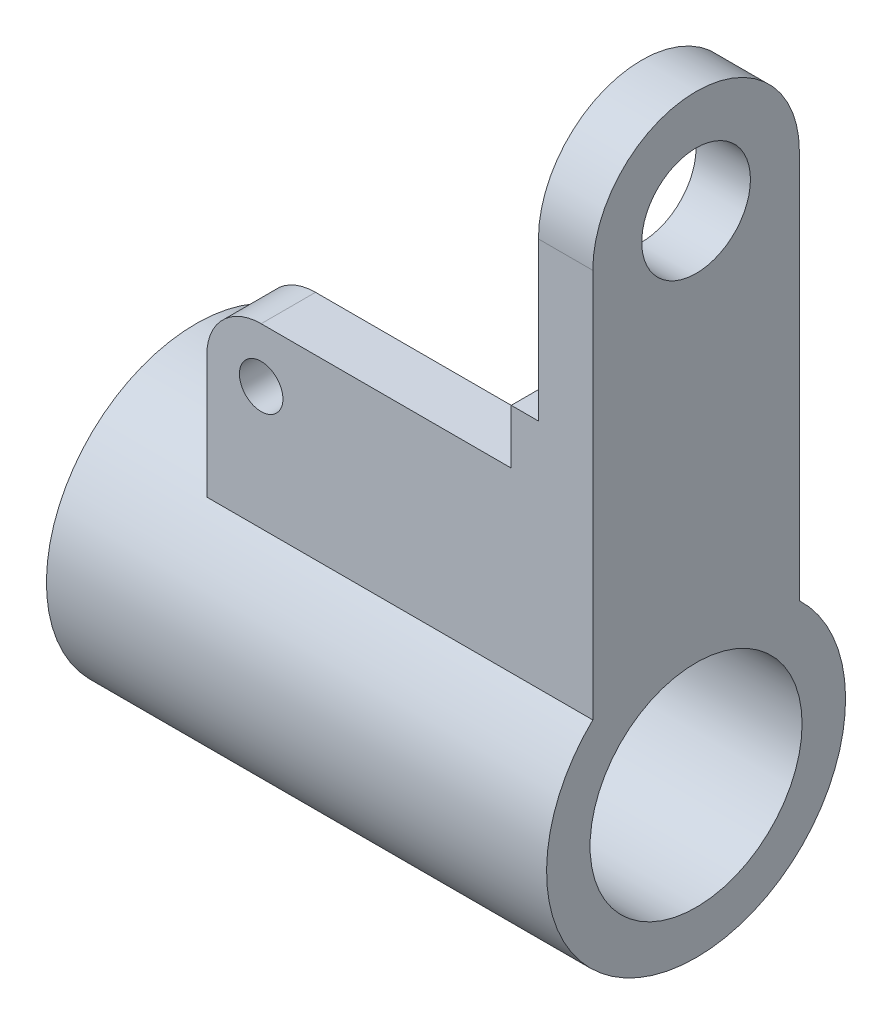
from build123d import *

# Parameters (mm, degrees)
SKETCH_1_R          = 27.5
SKETCH_1_R_2        = 19.5
EXTRUDE_1_DEPTH     = 92
EXTRUDE_START       = -15
SKETCH_2_R          = 10
EXTRUDE_2_DEPTH     = 15
CUT_EXTRUDE_1_REACH = 153.118
SKETCH_3_W          = 5
SKETCH_3_H          = 48
EXTRUDE_START_2     = 56
EXTRUDE_3_DEPTH     = 56
FILLET_1_R          = 10
CUT_EXTRUDE_2_REACH = 153.118
SKETCH_7_R          = 4


with BuildPart() as part:
    # 草图1 → 凸台-拉伸1 (new body)
    with BuildSketch(Plane(origin=(0, 0, 0), x_dir=(0, 0, -1), z_dir=(1, 0, 0))):
        Circle(SKETCH_1_R)
        Circle(SKETCH_1_R_2, mode=Mode.SUBTRACT)
    extrude(amount=EXTRUDE_1_DEPTH)

    # 草图2 → 凸台-拉伸2 (add)
    with BuildSketch(Plane(origin=(92, 0, 0), x_dir=(0, 0, -1), z_dir=(1, 0, 0)).offset(EXTRUDE_START)):
        with BuildLine():
            Line((-19, 19.880895352), (-19, 91.5))
            ThreePointArc((-19, 91.5), (0, 110.5), (19, 91.5))
            Line((19, 91.5), (19, 19.880895352))
            ThreePointArc((19, 19.880895352), (0, 27.5), (-19, 19.880895352))
        make_face()
        with Locations((0, 91.5)):
            Circle(SKETCH_2_R, mode=Mode.SUBTRACT)
    extrude(amount=EXTRUDE_2_DEPTH)

    # 草图3 → 切除-拉伸1 (cut, up to next)
    with BuildSketch(Plane.XY.offset(19), mode=Mode.PRIVATE) as cut_extrude_1_sk1:
        with Locations((79.5, 86.5)):
            Rectangle(SKETCH_3_W, SKETCH_3_H)
    cut_extrude_1_tool1 = extrude(cut_extrude_1_sk1.sketch, amount=-CUT_EXTRUDE_1_REACH, mode=Mode.PRIVATE) & part.part
    add(cut_extrude_1_tool1.solids().sort_by_distance((79.5, 86.5, 19))[0], mode=Mode.SUBTRACT)

    # 草图6 → 凸台-拉伸3 (add)
    with BuildSketch(Plane.ZY.offset(-77).offset(EXTRUDE_START_2)):
        with BuildLine():
            Line((19, 19.880895352), (19, 52.5))
            Line((19, 52.5), (9, 52.5))
            Line((9, 52.5), (9, 25.98557292))
            ThreePointArc((9, 25.98557292), (14.328878953, 23.471966853), (19, 19.880895352))
        make_face()
    extrude(amount=-EXTRUDE_3_DEPTH)

    # 圆角1
    fillet_1_edges = [part.edges().sort_by_distance(p)[0] for p in [
        (21, 52.5, 14),
    ]]
    fillet(fillet_1_edges, radius=FILLET_1_R)

    # 草图7 → 切除-拉伸2 (cut, up to next)
    with BuildSketch(Plane.XY.offset(19), mode=Mode.PRIVATE) as cut_extrude_2_sk1:
        with Locations((31, 42.5)):
            Circle(SKETCH_7_R)
    cut_extrude_2_tool1 = extrude(cut_extrude_2_sk1.sketch, amount=-CUT_EXTRUDE_2_REACH, mode=Mode.PRIVATE) & part.part
    add(cut_extrude_2_tool1.solids().sort_by_distance((31, 42.5, 19))[0], mode=Mode.SUBTRACT)


solid = part.part
